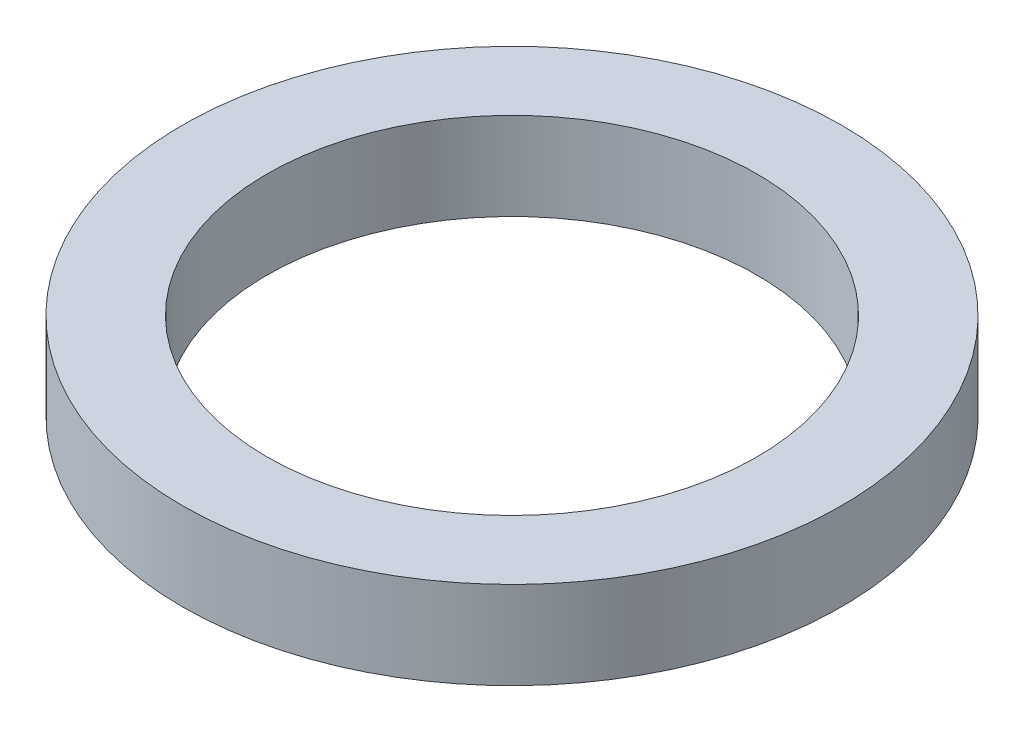
from build123d import *

# Parameters (mm, degrees)
SKETCH1_R           = 34.965
SKETCH1_R_2         = 26
BOSS_EXTRUDE1_DEPTH = 4.65


with BuildPart() as part:
    # Sketch1 → Boss-Extrude1 (new, symmetric)
    with BuildSketch(Plane(origin=(0, 0, 0), x_dir=(1, 0, 0), z_dir=(0, 1, 0))):
        with Locations(Location((0, 0, 0), (0, 0, 270))):
            Circle(SKETCH1_R)
        with Locations(Location((0, 0, 0), (0, 0, 270))):
            Circle(SKETCH1_R_2, mode=Mode.SUBTRACT)
    extrude(amount=BOSS_EXTRUDE1_DEPTH, both=True)


solid = part.part
